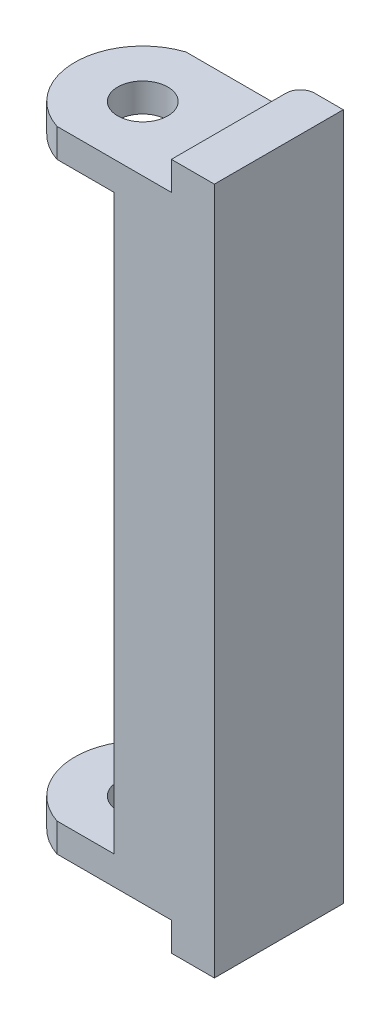
from build123d import *

# Parameters (mm, degrees)
SKETCH1_R           = 1.75
BOSS_EXTRUDE3_DEPTH = 2
BOSS_EXTRUDE4_DEPTH = 20
BOSS_EXTRUDE5_DEPTH = 4


with BuildPart() as part:
    # Sketch1 → Boss-Extrude3 (new body)
    with BuildSketch(Plane(origin=(0, 0, 0), x_dir=(1, 0, 0), z_dir=(0, 1, 0))):
        with BuildLine():
            ThreePointArc((-3.991008085, 4.5), (-7.240580672, 0), (-3.991008085, -4.5))
            Line((-3.991008085, -4.5), (7, -4.5))
            Line((7, -4.5), (7, 4.5))
            Line((7, 4.5), (-3.991008085, 4.5))
        make_face()
        with Locations((-2.5, 0)):
            Circle(SKETCH1_R, mode=Mode.SUBTRACT)
    extrude(amount=BOSS_EXTRUDE3_DEPTH)

    # Sketch1<3> → Boss-Extrude4 (add)
    with BuildSketch(Plane(origin=(0, 0, 0), x_dir=(1, 0, 0), z_dir=(0, 1, 0))):
        with BuildLine():
            ThreePointArc((0.004495957, 4.5), (2.65, 0), (0.004495957, -4.5))
            Line((0.004495957, -4.5), (7, -4.5))
            Line((7, -4.5), (7, 4.5))
            Line((7, 4.5), (0.004495957, 4.5))
        make_face()
    extrude(amount=-BOSS_EXTRUDE4_DEPTH)

    # Sketch1<5> → Boss-Extrude5 (add)
    with BuildSketch(Plane(origin=(0, 0, 0), x_dir=(1, 0, 0), z_dir=(0, 1, 0))):
        with BuildLine():
            Line((7, 4.5), (5, 4.5))
            ThreePointArc((5, 4.5), (4.292893219, 4.207106781), (4, 3.5))
            Line((4, 3.5), (4, -4.5))
            Line((4, -4.5), (7, -4.5))
            Line((7, -4.5), (7, 4.5))
        make_face()
    extrude(amount=BOSS_EXTRUDE5_DEPTH)

    # Mirror1: part across plane


with BuildPart() as part_1:
    add(part.part)
    add(part.part.mirror(Plane.ZX.offset(-20)))


solid = part_1.part
